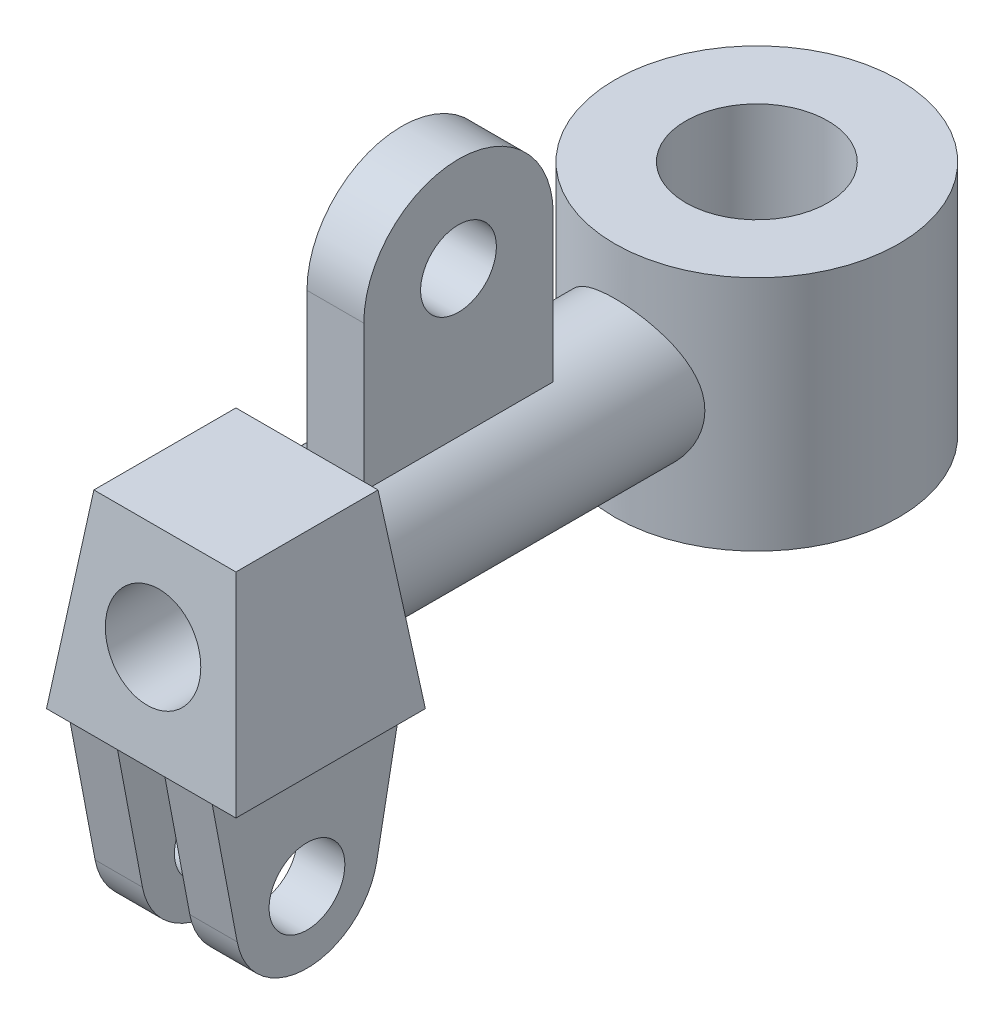
from build123d import *

# Parameters (mm, degrees)
SKETCH1_W                      = 40
SKETCH1_H                      = 40
BOSS_EXTRUDE1_DEPTH            = 40
BOSS_EXTRUDE1_TAPER            = 7.125
SKETCH2_R                      = 30
BOSS_EXTRUDE2_DEPTH            = 25
BOSS_EXTRUDE3_REACH            = 152.083
BOSS_EXTRUDE3_END_RADIUS       = 30
SKETCH3_R                      = 15
BOSS_EXTRUDE4_START            = -5
SKETCH4_R                      = 8
BOSS_EXTRUDE4_DEPTH            = 12
BOSS_EXTRUDE5_START            = 5
SKETCH5_R                      = 8
BOSS_EXTRUDE5_DEPTH            = 10
CUT_EXTRUDE1_REACH             = 168
SKETCH8_R                      = 10
CUT_EXTRUDE1_DIRECTION_2_DEPTH = 100
HOLE1_D                        = 30


with BuildPart() as part:
    # Sketch1 → Boss-Extrude1 (new body)
    with BuildSketch(Plane(origin=(0, 0, 0), x_dir=(1, 0, 0), z_dir=(0, 1, 0))):
        Rectangle(SKETCH1_W, SKETCH1_H)
    extrude(amount=BOSS_EXTRUDE1_DEPTH, taper=BOSS_EXTRUDE1_TAPER)



with BuildPart() as body_2:
    # Sketch2 → Boss-Extrude2 (new, symmetric)
    with BuildSketch(Plane(origin=(0, 20, 0), x_dir=(1, 0, 0), z_dir=(0, 1, 0))):
        with Locations(Location((0, 110, 0), (0, 0, 270))):
            Circle(SKETCH2_R)
    extrude(amount=BOSS_EXTRUDE2_DEPTH, both=True)


with BuildPart() as part_1:
    add(part.part)

    add(body_2.part)  # Boss-Extrude3 merges body 2
    # Boss-Extrude3: up to this cylinder (the profile starts outside it)
    boss_extrude3_end = Plane(origin=(0, 20, -110), z_dir=(0, -1, 0)) * Cylinder(BOSS_EXTRUDE3_END_RADIUS, 365.166, mode=Mode.PRIVATE)
    # Sketch3 → Boss-Extrude3 (add, up to the surface)
    with BuildSketch(Plane.XY, mode=Mode.PRIVATE) as boss_extrude3_sk1:
        with Locations((0, 20)):
            Circle(SKETCH3_R)
    boss_extrude3_tool1 = extrude(boss_extrude3_sk1.sketch, amount=-BOSS_EXTRUDE3_REACH, mode=Mode.PRIVATE) - boss_extrude3_end
    add(boss_extrude3_tool1.solids().sort_by_distance((0, 20, 0))[0])

    # Sketch4 → Boss-Extrude4 (add)
    with BuildSketch(Plane(origin=(0, 0, 0), x_dir=(0, 0, -1), z_dir=(1, 0, 0)).offset(BOSS_EXTRUDE4_START)):
        with BuildLine():
            Line((20, 64), (20, 20))
            Line((20, 20), (60, 20))
            Line((60, 20), (60, 64))
            ThreePointArc((60, 64), (40, 84), (20, 64))
        make_face()
        with Locations((40, 64)):
            Circle(SKETCH4_R, mode=Mode.SUBTRACT)
    extrude(amount=BOSS_EXTRUDE4_DEPTH)

    # Sketch5 → Boss-Extrude5 (add)
    with BuildSketch(Plane(origin=(0, 0, 0), x_dir=(0, 0, -1), z_dir=(1, 0, 0)).offset(BOSS_EXTRUDE5_START)):
        with BuildLine():
            Line((-20, 0), (20, 0))
            Line((20, 0), (14.738148017, -27.790518414))
            ThreePointArc((14.738148017, -27.790518414), (0, -40), (-14.738148017, -27.790518414))
            Line((-14.738148017, -27.790518414), (-20, 0))
        make_face()
        with Locations((0, -25)):
            Circle(SKETCH5_R, mode=Mode.SUBTRACT)
    boss_extrude5 = extrude(amount=BOSS_EXTRUDE5_DEPTH)

    # Mirror1: Boss-Extrude5 across plane
    add(boss_extrude5.mirror(Plane(origin=(0, 0, 0), x_dir=(0, 0, 1), z_dir=(1, 0, 0))))

    # Cut-Extrude1: up to this plane
    cut_extrude1_end = Plane(origin=(-20, 0, 20), z_dir=(0, 0.1240344514504856, 0.9922779121059669))
    # Sketch8 → Cut-Extrude1 (cut, up to the surface)
    with BuildSketch(Plane.XY, mode=Mode.PRIVATE) as cut_extrude1_sk1:
        with Locations((0, 20)):
            Circle(SKETCH8_R)
    cut_extrude1_tool1 = split(extrude(cut_extrude1_sk1.sketch, amount=CUT_EXTRUDE1_REACH, mode=Mode.PRIVATE), bisect_by=cut_extrude1_end, keep=Keep.BOTH, mode=Mode.PRIVATE)
    add(cut_extrude1_tool1.solids().sort_by_distance((0, 20, 0))[0], mode=Mode.SUBTRACT)

    # Sketch8 → Cut-Extrude1 direction 2 (cut)
    with BuildSketch(Plane.XY):
        with Locations((0, 20)):
            Circle(SKETCH8_R)
    extrude(amount=-CUT_EXTRUDE1_DIRECTION_2_DEPTH, mode=Mode.SUBTRACT)

    # Hole1 (through all)
    with Locations(Plane(origin=(0, 45, 0), x_dir=(1, 0, 0), z_dir=(0, 1, 0))):
        with Locations((0, 110)):
            Hole(HOLE1_D / 2)


solid = part_1.part
